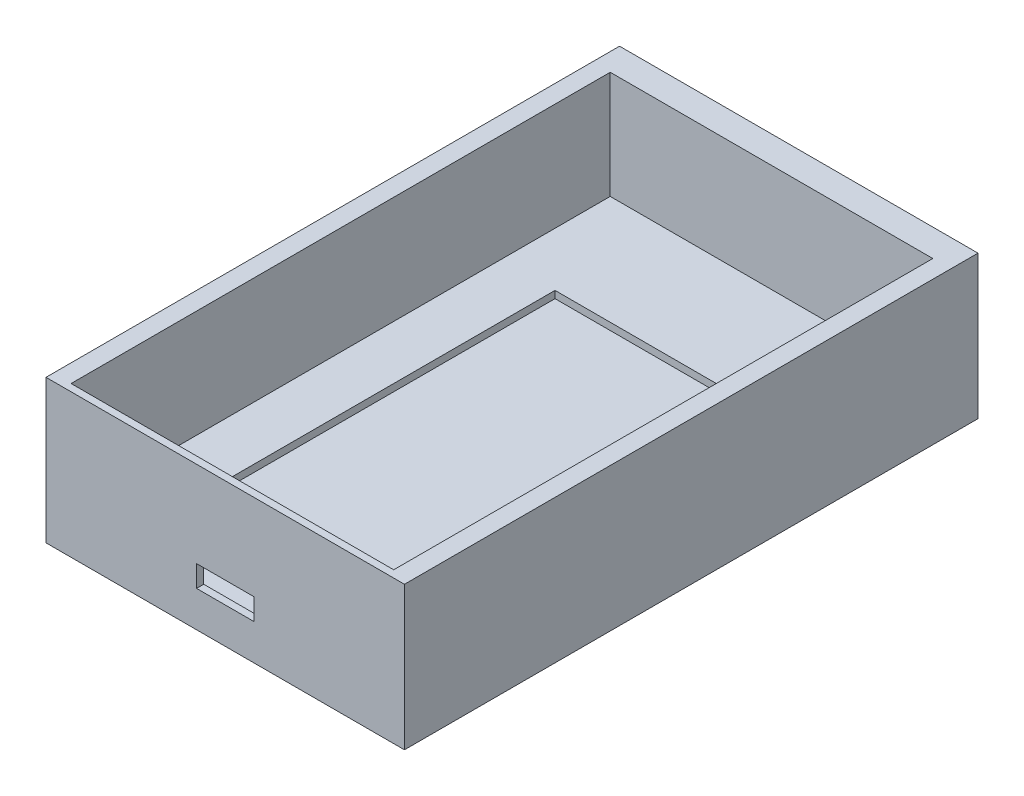
from build123d import *

# Parameters (mm, degrees)
SKETCH1_W           = 50
SKETCH1_H           = 20
BOSS_EXTRUDE1_DEPTH = 40
SKETCH2_W           = 45
SKETCH2_H           = 75.2
CUT_EXTRUDE1_DEPTH  = 15
CUT_EXTRUDE2_REACH  = 86.41
SKETCH3_W           = 8
SKETCH3_H           = 3
SKETCH4_W           = 30
SKETCH4_H           = 60
CUT_EXTRUDE3_DEPTH  = 1


with BuildPart() as part:
    # Sketch1 → Boss-Extrude1 (new, symmetric)
    with BuildSketch(Plane.XY):
        Rectangle(SKETCH1_W, SKETCH1_H)
    extrude(amount=BOSS_EXTRUDE1_DEPTH, both=True)

    # Sketch2 → Cut-Extrude1 (cut)
    with BuildSketch(Plane(origin=(0, 10, 0), x_dir=(1, 0, 0), z_dir=(0, 1, 0))):
        with Locations((0, -1.4)):
            Rectangle(SKETCH2_W, SKETCH2_H)
    extrude(amount=-CUT_EXTRUDE1_DEPTH, mode=Mode.SUBTRACT)

    # Sketch3 → Cut-Extrude2 (cut, up to next)
    with BuildSketch(Plane.XY.offset(40), mode=Mode.PRIVATE) as cut_extrude2_sk1:
        with Locations((0, -3.5)):
            Rectangle(SKETCH3_W, SKETCH3_H)
    cut_extrude2_tool1 = extrude(cut_extrude2_sk1.sketch, amount=-CUT_EXTRUDE2_REACH, mode=Mode.PRIVATE) & part.part
    add(cut_extrude2_tool1.solids().sort_by_distance((0, -3.5, 40))[0], mode=Mode.SUBTRACT)

    # Sketch4 → Cut-Extrude3 (cut)
    with BuildSketch(Plane(origin=(0, -5, 0), x_dir=(1, 0, 0), z_dir=(0, 1, 0))):
        with Locations((0, -9)):
            Rectangle(SKETCH4_W, SKETCH4_H)
    extrude(amount=-CUT_EXTRUDE3_DEPTH, mode=Mode.SUBTRACT)


solid = part.part
